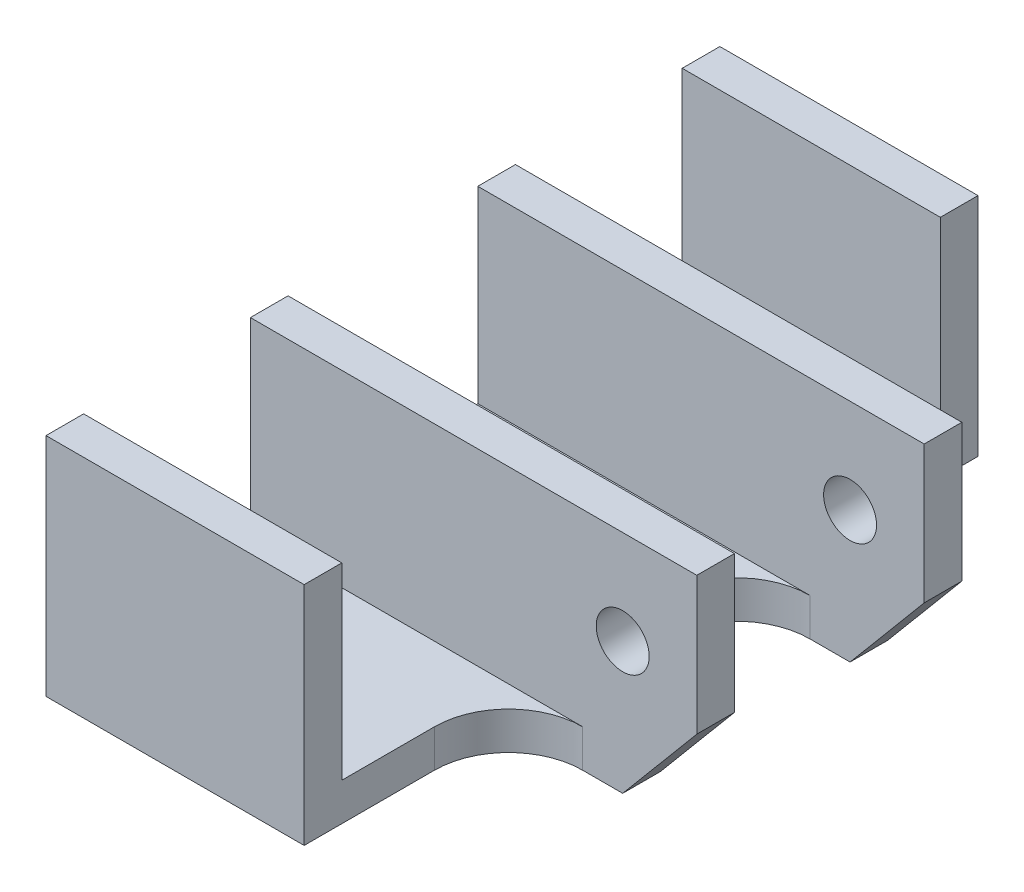
from build123d import *

# Parameters (mm, degrees)
BOSS_EXTRUDE1_DEPTH     = 34.83
SKETCH3_W               = 5.08
SKETCH3_H               = 30.48
BOSS_EXTRUDE2_DEPTH     = 25.4
F_1_4_CLEARANCE_HOLE1_D = 7.14248
CHAMFER1_SIZE           = 10
CHAMFER1_SIZE2          = 11.917535926
FILLET1_R               = 10
F_1_4_CLEARANCE_HOLE2_D = 7.14248


with BuildPart() as part:
    # Sketch2 → Boss-Extrude1 (new body)
    with BuildSketch(Plane(origin=(0, 0, 0), x_dir=(0, 0, -1), z_dir=(1, 0, 0))):
        Polygon((-12.8, 0), (-12.8, 25.4), (-17.88, 25.4), (-17.88, 0), (-40.38, 0), (-40.38, 25.4), (-45.46, 25.4), (-45.46, -5.08), (45.46, -5.08), (45.46, 25.4), (40.38, 25.4), (40.38, 0), (17.88, 0), (17.88, 25.4), (12.8, 25.4), (12.8, 0), align=None)
    extrude(amount=BOSS_EXTRUDE1_DEPTH)

    # Sketch3 → Boss-Extrude2 (add)
    with BuildSketch(Plane(origin=(34.83, 0, 0), x_dir=(0, 0, -1), z_dir=(1, 0, 0))):
        with Locations((-15.34, 10.16)):
            Rectangle(SKETCH3_W, SKETCH3_H)
        with Locations((15.34, 10.16)):
            Rectangle(SKETCH3_W, SKETCH3_H)
    extrude(amount=BOSS_EXTRUDE2_DEPTH)

    # 1/4 Clearance Hole1 (through all)
    with Locations(Plane.XY.offset(17.88)):
        with Locations((50.23, 12.7)):
            Hole(F_1_4_CLEARANCE_HOLE1_D / 2)

    # Chamfer1
    chamfer1_edges = [part.edges().sort_by_distance(p)[0] for p in [
        (60.23, -5.08, -15.34),
        (60.23, -5.08, 15.34),
    ]]
    chamfer1_side = [part.faces().sort_by_distance(p)[0] for p in [
        (19.684206994, -5.08, 0),
    ]]
    chamfer(chamfer1_edges, length=CHAMFER1_SIZE, length2=CHAMFER1_SIZE2, reference=chamfer1_side[0])

    # Fillet1
    fillet1_edges = [part.edges().sort_by_distance(p)[0] for p in [
        (34.83, -2.54, -12.8),
        (34.83, -2.54, -17.88),
        (34.83, -2.54, 12.8),
        (34.83, -2.54, 17.88),
    ]]
    fillet(fillet1_edges, radius=FILLET1_R)

    # 1/4 Clearance Hole2 (through all)
    with Locations(Plane(origin=(0, -5.08, 0), x_dir=(-1, 0, 0), z_dir=(0, -1, 0))):
        with Locations((-17.415, 0)):
            Hole(F_1_4_CLEARANCE_HOLE2_D / 2)


solid = part.part
